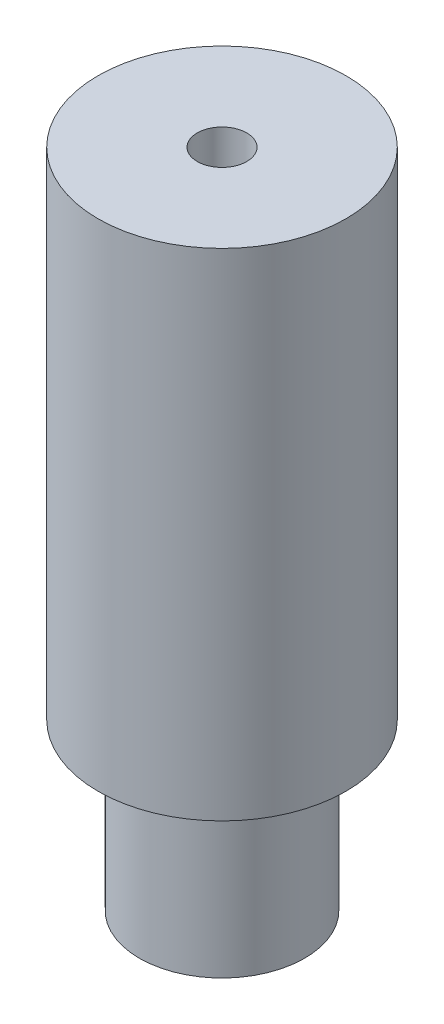
from build123d import *

# Parameters (mm, degrees)
SKETCH1_R           = 5
BOSS_EXTRUDE1_DEPTH = 10
SKETCH2_R           = 7.5
BOSS_EXTRUDE2_DEPTH = 30
SKETCH4_R           = 3
CUT_EXTRUDE1_DEPTH  = 20
SKETCH5_R           = 1.5
CUT_EXTRUDE2_DEPTH  = 20


with BuildPart() as part:
    # Sketch1 → Boss-Extrude1 (new body)
    with BuildSketch(Plane(origin=(0, 0, 0), x_dir=(1, 0, 0), z_dir=(0, 1, 0))):
        with Locations(Location((0, 0, 0), (0, 0, 270))):
            Circle(SKETCH1_R)
    extrude(amount=BOSS_EXTRUDE1_DEPTH)

    # Sketch2 → Boss-Extrude2 (add)
    with BuildSketch(Plane(origin=(0, 10, 0), x_dir=(1, 0, 0), z_dir=(0, 1, 0))):
        with Locations(Location((0, 0, 0), (0, 0, 270))):
            Circle(SKETCH2_R)
    extrude(amount=BOSS_EXTRUDE2_DEPTH)

    # Sketch4 → Cut-Extrude1 (cut)
    with BuildSketch(Plane.XZ):
        with Locations(Location((0, 0, 0), (0, 0, 270))):
            Circle(SKETCH4_R)
    extrude(amount=-CUT_EXTRUDE1_DEPTH, mode=Mode.SUBTRACT)

    # Sketch5 → Cut-Extrude2 (cut)
    with BuildSketch(Plane(origin=(0, 40, 0), x_dir=(1, 0, 0), z_dir=(0, 1, 0))):
        with Locations(Location((0, 0, 0), (0, 0, 270))):
            Circle(SKETCH5_R)
    extrude(amount=-CUT_EXTRUDE2_DEPTH, mode=Mode.SUBTRACT)


solid = part.part
